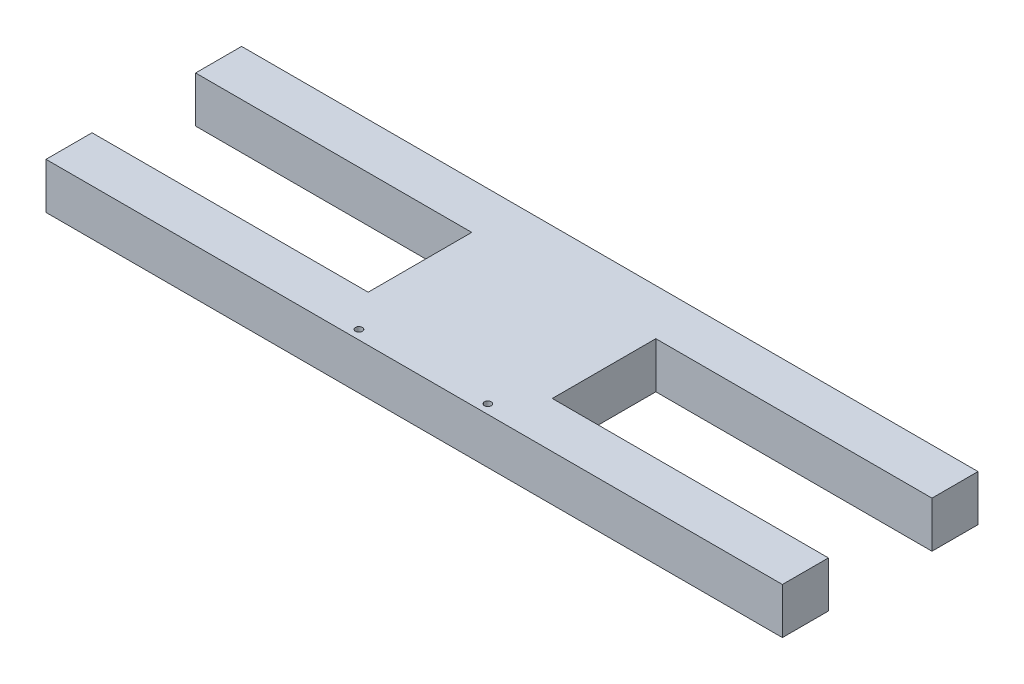
from build123d import *

# Parameters (mm, degrees)
SKETCH1_W           = 80
SKETCH1_H           = 45
BOSS_EXTRUDE2_DEPTH = 20
SKETCH3_R           = 1.5
CUT_EXTRUDE7_DEPTH  = 20


with BuildPart() as part:
    # Sketch1 → Boss-Extrude2 (new body)
    with BuildSketch(Plane(origin=(0, 0, 0), x_dir=(1, 0, 0), z_dir=(0, 1, 0))):
        Polygon((-40, -22.5), (-160, -22.5), (-160, -42.5), (160, -42.5), (160, -22.5), (40, -22.5), align=None)
        Rectangle(SKETCH1_W, SKETCH1_H)
        Polygon((160, 42.5), (-160, 42.5), (-160, 22.5), (-40, 22.5), (40, 22.5), (160, 22.5), align=None)
    extrude(amount=BOSS_EXTRUDE2_DEPTH)

    # Sketch3 → Cut-Extrude7 (cut)
    with BuildSketch(Plane(origin=(0, 20, 0), x_dir=(1, 0, 0), z_dir=(0, 1, 0))):
        with Locations(Location((-28, -38.5, 0), (0, 0, 270))):
            Circle(SKETCH3_R)
        with Locations(Location((28, -38.5, 0), (0, 0, 270))):
            Circle(SKETCH3_R)
    extrude(amount=-CUT_EXTRUDE7_DEPTH, mode=Mode.SUBTRACT)


solid = part.part
